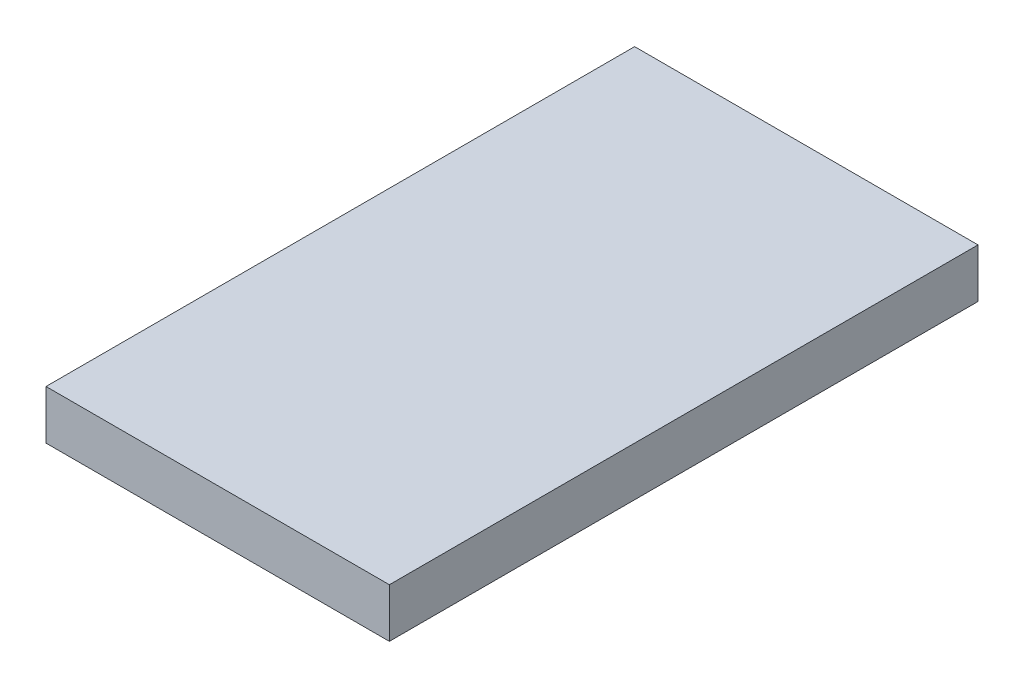
from build123d import *

# Parameters (mm, degrees)
SKETCH1_W           = 42
SKETCH1_H           = 72
BOSS_EXTRUDE1_DEPTH = 6


with BuildPart() as part:
    # Sketch1 → Boss-Extrude1 (new body)
    with BuildSketch(Plane(origin=(0, 0, 0), x_dir=(1, 0, 0), z_dir=(0, 1, 0))):
        Rectangle(SKETCH1_W, SKETCH1_H)
    extrude(amount=BOSS_EXTRUDE1_DEPTH)


solid = part.part
